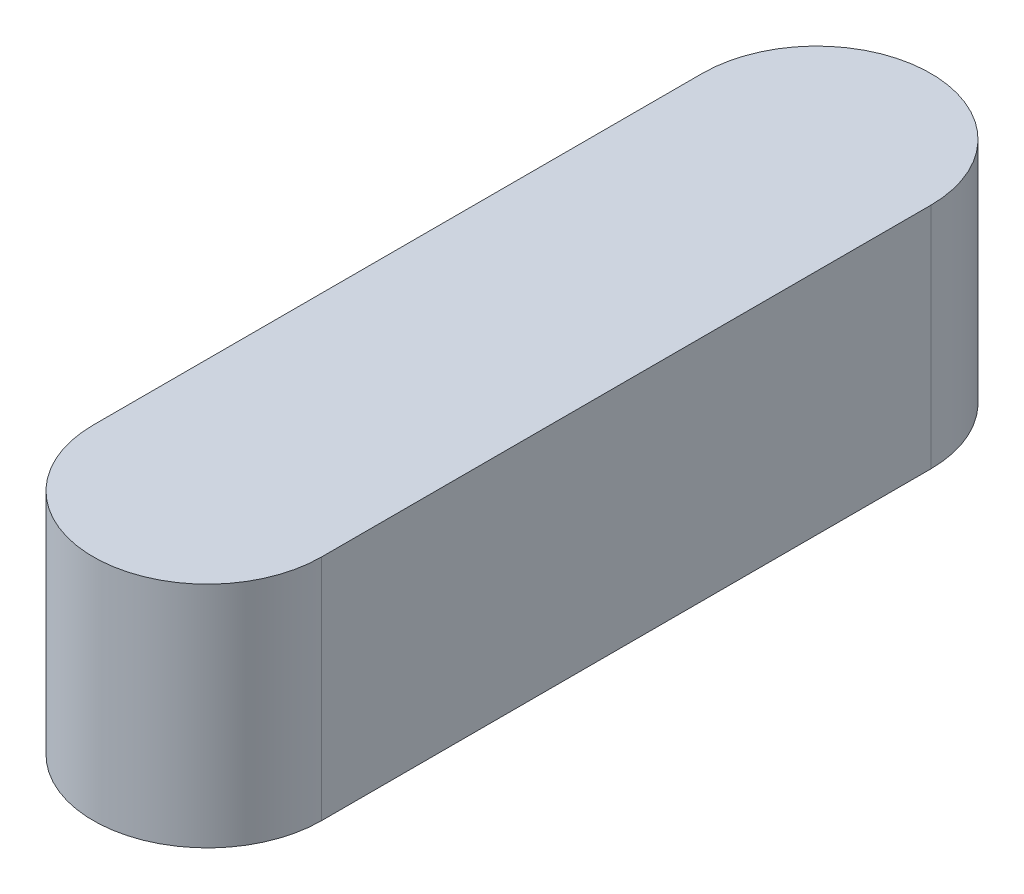
from build123d import *

# Parameters (mm, degrees)
SKETCH1_W           = 6
SKETCH1_H           = 6
BOSS_EXTRUDE1_DEPTH = 8
BOSS_EXTRUDE2_DEPTH = 6


with BuildPart() as part:
    # Sketch1 → Boss-Extrude1 (new, symmetric)
    with BuildSketch(Plane.XY):
        Rectangle(SKETCH1_W, SKETCH1_H)
    extrude(amount=BOSS_EXTRUDE1_DEPTH, both=True)

    # Sketch2 → Boss-Extrude2 (add)
    with BuildSketch(Plane.XZ.offset(3)):
        with BuildLine():
            Line((-3, 8), (3, 8))
            ThreePointArc((3, 8), (0, 11), (-3, 8))
        make_face()
        with BuildLine():
            Line((-3, -8), (3, -8))
            ThreePointArc((3, -8), (0, -11), (-3, -8))
        make_face()
    extrude(amount=-BOSS_EXTRUDE2_DEPTH)


solid = part.part
